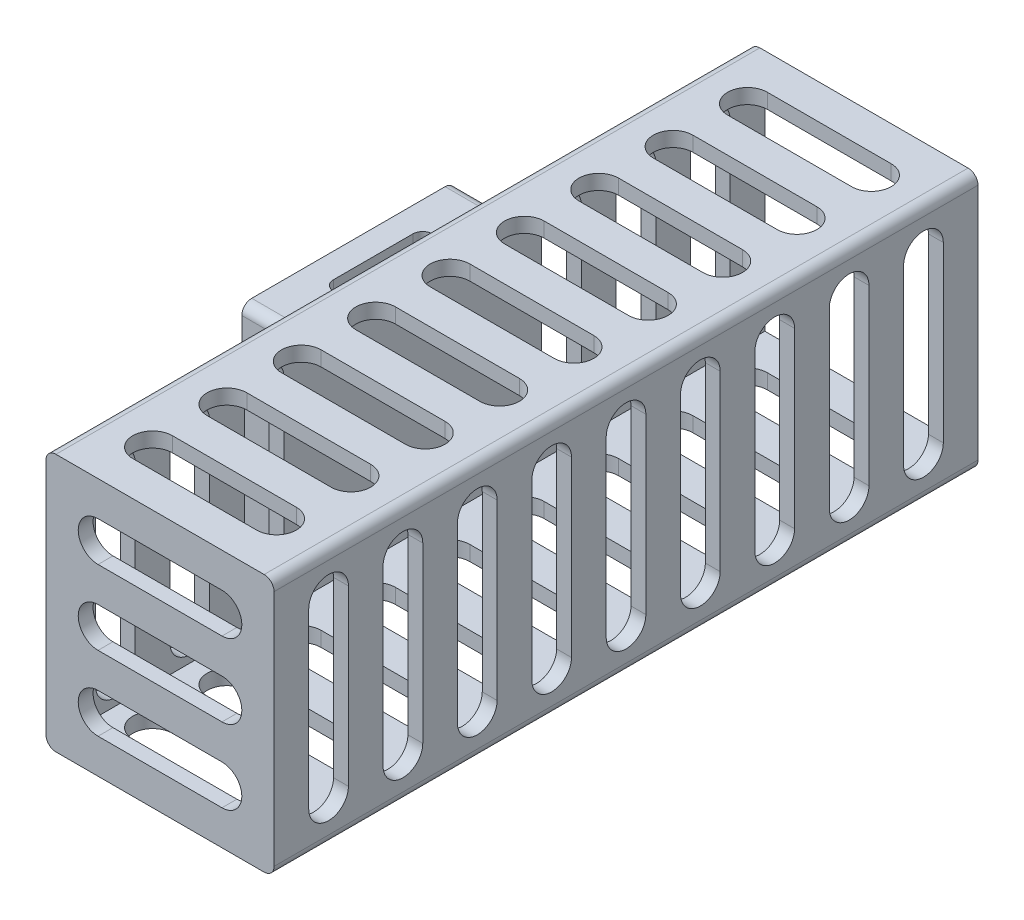
from build123d import *

# Parameters (mm, degrees)
SKETCH_1_W           = 49
SKETCH_1_H           = 43
SKETCH_1_W_2         = 45
SKETCH_1_H_2         = 39
EXTRUDE_1_DEPTH      = 140
SKETCH_3_W           = 49
SKETCH_3_H           = 43
EXTRUDE_1_2_DEPTH    = 2
SKETCH_4_W           = 43
SKETCH_4_H           = 43
EXTRUDE_2_DEPTH      = 10
SKETCH_5_W           = 39
SKETCH_5_H           = 39
CUT_EXTRUDE_1_DEPTH  = 5
SKETCH_6_W           = 5
SKETCH_6_H           = 20
CUT_EXTRUDE_2_DEPTH  = 151.463450711
SKETCH_8_W           = 20
SKETCH_8_H           = 8
EXTRUDE_4_DEPTH      = 5
SKETCH_9_W           = 29.5
SKETCH_9_H           = 15.5
CUT_EXTRUDE_3_DEPTH  = 5
SKETCH_10_R          = 1.5
CUT_EXTRUDE_4_DEPTH  = 3
CUT_EXTRUDE_START    = -3
SKETCH_11_R          = 1.5
CUT_EXTRUDE_5_DEPTH  = 3
FILLET_1_R           = 2
SKETCH_12_W          = 10.000025874
SKETCH_12_H          = 8
CUT_EXTRUDE_6_DEPTH  = 5
FILLET_2_R           = 2
FILLET_3_R           = 2
FILLET_4_R           = 2
SKETCH_14_W          = 49
SKETCH_14_H          = 43
CUT_EXTRUDE_7_DEPTH  = 148.704096084
SKETCH_15_W          = 142
SKETCH_15_H          = 52
EXTRUDE_5_DEPTH      = 46
SKETCH_16_W          = 40
SKETCH_16_H          = 46
CUT_EXTRUDE_8_DEPTH  = 139
CUT_EXTRUDE_9_DEPTH  = 154.278341588
CUT_EXTRUDE_10_DEPTH = 10
CUT_EXTRUDE_START_2  = -10
CUT_EXTRUDE_11_DEPTH = 10
FILLET_5_R           = 2
CUT_EXTRUDE_12_DEPTH = 10


with BuildPart() as part:
    # 草图1 → Extrude 1 (new body)
    with BuildSketch(Plane.XY):
        Rectangle(SKETCH_1_W, SKETCH_1_H)
        Rectangle(SKETCH_1_W_2, SKETCH_1_H_2, mode=Mode.SUBTRACT)
    extrude(amount=EXTRUDE_1_DEPTH)

    # 草图3 → Extrude 1 2 (add)
    with BuildSketch(Plane(origin=(0, 0, 0), x_dir=(-1, 0, 0), z_dir=(0, 0, -1))):
        Rectangle(SKETCH_3_W, SKETCH_3_H)
    extrude(amount=EXTRUDE_1_2_DEPTH)

    # 草图4 → 凸台-拉伸2 (add)
    with BuildSketch(Plane.ZY.offset(24.5)):
        with Locations((69, 0)):
            Rectangle(SKETCH_4_W, SKETCH_4_H)
    extrude(amount=EXTRUDE_2_DEPTH)

    # 草图5 → 切除-拉伸1 (cut)
    with BuildSketch(Plane.ZY.offset(34.5)):
        with Locations((69, 0)):
            Rectangle(SKETCH_5_W, SKETCH_5_H)
    extrude(amount=-CUT_EXTRUDE_1_DEPTH, mode=Mode.SUBTRACT)

    # 草图6 → 切除-拉伸2 (cut, through all)
    with BuildSketch(Plane(origin=(0, 21.5, 0), x_dir=(1, 0, 0), z_dir=(0, 1, 0))):
        with Locations((-27, -69)):
            Rectangle(SKETCH_6_W, SKETCH_6_H)
    extrude(amount=-CUT_EXTRUDE_2_DEPTH, mode=Mode.SUBTRACT)

    # 草图8 → 凸台-拉伸4 (add)
    with BuildSketch(Plane.ZY.offset(24.5)):
        with Locations((69, 0)):
            Rectangle(SKETCH_8_W, SKETCH_8_H)
    extrude(amount=EXTRUDE_4_DEPTH)

    # 草图9 → 切除-拉伸3 (cut)
    with BuildSketch(Plane.ZY.offset(29.5)):
        with Locations((69, 11.75)):
            Rectangle(SKETCH_9_W, SKETCH_9_H)
        with Locations((69, -11.75)):
            Rectangle(SKETCH_9_W, SKETCH_9_H)
    extrude(amount=-CUT_EXTRUDE_3_DEPTH, mode=Mode.SUBTRACT)

    # 草图10 → 切除-拉伸4 (cut)
    with BuildSketch(Plane.XZ.offset(4)):
        with Locations((-27, 78.5)):
            Circle(SKETCH_10_R)
        with Locations(Location((-27, 59.5, 0), (0, 0, 180))):
            Circle(SKETCH_10_R)
    extrude(amount=-CUT_EXTRUDE_4_DEPTH, mode=Mode.SUBTRACT)

    # 草图11 → 切除-拉伸5 (cut)
    with BuildSketch(Plane(origin=(0, 4, 0), x_dir=(1, 0, 0), z_dir=(0, 1, 0)).offset(CUT_EXTRUDE_START)):
        with Locations(Location((-27, -59.5, 0), (0, 0, 180))):
            Circle(SKETCH_11_R)
        with Locations((-27, -78.5)):
            Circle(SKETCH_11_R)
    extrude(amount=CUT_EXTRUDE_5_DEPTH, mode=Mode.SUBTRACT)

    # 圆角1
    fillet_1_edges = [part.edges().sort_by_distance(p)[0] for p in [
        (-24.5, 20.5, 79),
        (-24.5, 20.5, 59),
        (-29.5, -20.5, 79),
        (-29.5, 20.5, 79),
        (-29.5, -20.5, 59),
        (-29.5, 20.5, 59),
        (-24.5, -20.5, 59),
        (-24.5, -20.5, 79),
    ]]
    fillet(fillet_1_edges, radius=FILLET_1_R)

    # 草图12 → 切除-拉伸6 (cut)
    with BuildSketch(Plane.ZY.offset(29.5)):
        with Locations((69, 0)):
            Rectangle(SKETCH_12_W, SKETCH_12_H)
    extrude(amount=-CUT_EXTRUDE_6_DEPTH, mode=Mode.SUBTRACT)

    # 圆角2
    fillet_2_edges = [part.edges().sort_by_distance(p)[0] for p in [
        (-32, -19.5, 49.5),
        (-32, 19.5, 49.5),
        (-32, 19.5, 88.5),
        (-32, -19.5, 88.5),
    ]]
    fillet(fillet_2_edges, radius=FILLET_2_R)

    # 圆角3
    fillet_3_edges = [part.edges().sort_by_distance(p)[0] for p in [
        (-29.5, 21.5, 47.5),
        (-29.5, -21.5, 47.5),
        (-29.5, -21.5, 90.5),
        (-29.5, 21.5, 90.5),
    ]]
    fillet(fillet_3_edges, radius=FILLET_3_R)

    # 圆角4
    fillet_4_edges = [part.edges().sort_by_distance(p)[0] for p in [
        (-27, 4, 83.75),
        (-27, 19.5, 54.25),
        (-27, 4, 54.25),
        (-27, 19.5, 83.75),
        (-27, -4, 54.25),
        (-27, -19.5, 83.75),
        (-27, -19.5, 54.25),
        (-27, -4, 83.75),
    ]]
    fillet(fillet_4_edges, radius=FILLET_4_R)

    # 草图14 → 切除-拉伸7 (cut, through all)
    with BuildSketch(Plane.XY.offset(140)):
        Rectangle(SKETCH_14_W, SKETCH_14_H)
    extrude(amount=-CUT_EXTRUDE_7_DEPTH, mode=Mode.SUBTRACT)

    # 草图15 → 凸台-拉伸5 (add)
    with BuildSketch(Plane(origin=(-24.5, 0, 0), x_dir=(0, 0, -1), z_dir=(1, 0, 0))):
        with Locations((-69, 0)):
            Rectangle(SKETCH_15_W, SKETCH_15_H)
    extrude(amount=EXTRUDE_5_DEPTH)

    # 草图16 → 切除-拉伸8 (cut)
    with BuildSketch(Plane(origin=(0, 0, -2), x_dir=(-1, 0, 0), z_dir=(0, 0, -1))):
        with Locations((1.5, 0)):
            Rectangle(SKETCH_16_W, SKETCH_16_H)
    extrude(amount=-CUT_EXTRUDE_8_DEPTH, mode=Mode.SUBTRACT)

    # 草图17 → 切除-拉伸9 (cut, through all)
    with BuildSketch(Plane.XZ.offset(26)):
        with BuildLine():
            Line((-14, 73), (11, 73))
            ThreePointArc((11, 73), (15, 69), (11, 65))
            Line((11, 65), (-14, 65))
            ThreePointArc((-14, 65), (-18, 69), (-14, 73))
        make_face()
        with BuildLine():
            Line((-14, 80), (11, 80))
            ThreePointArc((11, 80), (15, 84), (11, 88))
            Line((11, 88), (-14, 88))
            ThreePointArc((-14, 88), (-18, 84), (-14, 80))
        make_face()
        with BuildLine():
            Line((-14, 95), (11, 95))
            ThreePointArc((11, 95), (15, 99), (11, 103))
            Line((11, 103), (-14, 103))
            ThreePointArc((-14, 103), (-18, 99), (-14, 95))
        make_face()
        with BuildLine():
            Line((-14, 110), (11, 110))
            ThreePointArc((11, 110), (15, 114), (11, 118))
            Line((11, 118), (-14, 118))
            ThreePointArc((-14, 118), (-18, 114), (-14, 110))
        make_face()
        with BuildLine():
            Line((-14, 125), (11, 125))
            ThreePointArc((11, 125), (15, 129), (11, 133))
            Line((11, 133), (-14, 133))
            ThreePointArc((-14, 133), (-18, 129), (-14, 125))
        make_face()
        with BuildLine():
            Line((-14, 50), (11, 50))
            ThreePointArc((11, 50), (15, 54), (11, 58))
            Line((11, 58), (-14, 58))
            ThreePointArc((-14, 58), (-18, 54), (-14, 50))
        make_face()
        with BuildLine():
            Line((-14, 35), (11, 35))
            ThreePointArc((11, 35), (15, 39), (11, 43))
            Line((11, 43), (-14, 43))
            ThreePointArc((-14, 43), (-18, 39), (-14, 35))
        make_face()
        with BuildLine():
            Line((-14, 20), (11, 20))
            ThreePointArc((11, 20), (15, 24), (11, 28))
            Line((11, 28), (-14, 28))
            ThreePointArc((-14, 28), (-18, 24), (-14, 20))
        make_face()
        with BuildLine():
            Line((-14, 5), (11, 5))
            ThreePointArc((11, 5), (15, 9), (11, 13))
            Line((11, 13), (-14, 13))
            ThreePointArc((-14, 13), (-18, 9), (-14, 5))
        make_face()
    extrude(amount=-CUT_EXTRUDE_9_DEPTH, mode=Mode.SUBTRACT)

    # 草图18 → 切除-拉伸10 (cut)
    with BuildSketch(Plane(origin=(21.5, 0, 0), x_dir=(0, 0, -1), z_dir=(1, 0, 0))):
        with BuildLine():
            Line((-65, 17.5), (-65, -17.5))
            ThreePointArc((-65, -17.5), (-69, -21.5), (-73, -17.5))
            Line((-73, -17.5), (-73, 17.5))
            ThreePointArc((-73, 17.5), (-69, 21.5), (-65, 17.5))
        make_face()
        with BuildLine():
            Line((-58, 17.5), (-58, -17.5))
            ThreePointArc((-58, -17.5), (-54, -21.5), (-50, -17.5))
            Line((-50, -17.5), (-50, 17.5))
            ThreePointArc((-50, 17.5), (-54, 21.5), (-58, 17.5))
        make_face()
        with BuildLine():
            Line((-43, 17.5), (-43, -17.5))
            ThreePointArc((-43, -17.5), (-39, -21.5), (-35, -17.5))
            Line((-35, -17.5), (-35, 17.5))
            ThreePointArc((-35, 17.5), (-39, 21.5), (-43, 17.5))
        make_face()
        with BuildLine():
            Line((-28, 17.5), (-28, -17.5))
            ThreePointArc((-28, -17.5), (-24, -21.5), (-20, -17.5))
            Line((-20, -17.5), (-20, 17.5))
            ThreePointArc((-20, 17.5), (-24, 21.5), (-28, 17.5))
        make_face()
        with BuildLine():
            Line((-13, 17.5), (-13, -17.5))
            ThreePointArc((-13, -17.5), (-9, -21.5), (-5, -17.5))
            Line((-5, -17.5), (-5, 17.5))
            ThreePointArc((-5, 17.5), (-9, 21.5), (-13, 17.5))
        make_face()
        with BuildLine():
            Line((-88, 17.5), (-88, -17.5))
            ThreePointArc((-88, -17.5), (-84, -21.5), (-80, -17.5))
            Line((-80, -17.5), (-80, 17.5))
            ThreePointArc((-80, 17.5), (-84, 21.5), (-88, 17.5))
        make_face()
        with BuildLine():
            Line((-103, 17.5), (-103, -17.5))
            ThreePointArc((-103, -17.5), (-99, -21.5), (-95, -17.5))
            Line((-95, -17.5), (-95, 17.5))
            ThreePointArc((-95, 17.5), (-99, 21.5), (-103, 17.5))
        make_face()
        with BuildLine():
            Line((-118, 17.5), (-118, -17.5))
            ThreePointArc((-118, -17.5), (-114, -21.5), (-110, -17.5))
            Line((-110, -17.5), (-110, 17.5))
            ThreePointArc((-110, 17.5), (-114, 21.5), (-118, 17.5))
        make_face()
        with BuildLine():
            Line((-133, 17.5), (-133, -17.5))
            ThreePointArc((-133, -17.5), (-129, -21.5), (-125, -17.5))
            Line((-125, -17.5), (-125, 17.5))
            ThreePointArc((-125, 17.5), (-129, 21.5), (-133, 17.5))
        make_face()
    extrude(amount=-CUT_EXTRUDE_10_DEPTH, mode=Mode.SUBTRACT)

    # 草图19 → 切除-拉伸11 (cut)
    with BuildSketch(Plane.ZY.offset(24.5).offset(CUT_EXTRUDE_START_2)):
        with BuildLine():
            Line((95, 17.5), (95, -17.5))
            ThreePointArc((95, -17.5), (99, -21.5), (103, -17.5))
            Line((103, -17.5), (103, 17.5))
            ThreePointArc((103, 17.5), (99, 21.5), (95, 17.5))
        make_face()
        with BuildLine():
            Line((110, 17.5), (110, -17.5))
            ThreePointArc((110, -17.5), (114, -21.5), (118, -17.5))
            Line((118, -17.5), (118, 17.5))
            ThreePointArc((118, 17.5), (114, 21.5), (110, 17.5))
        make_face()
        with BuildLine():
            Line((125, 17.5), (125, -17.5))
            ThreePointArc((125, -17.5), (129, -21.5), (133, -17.5))
            Line((133, -17.5), (133, 17.5))
            ThreePointArc((133, 17.5), (129, 21.5), (125, 17.5))
        make_face()
        with BuildLine():
            Line((35, 17.5), (35, -17.5))
            ThreePointArc((35, -17.5), (39, -21.5), (43, -17.5))
            Line((43, -17.5), (43, 17.5))
            ThreePointArc((43, 17.5), (39, 21.5), (35, 17.5))
        make_face()
        with BuildLine():
            Line((20, 17.5), (20, -17.5))
            ThreePointArc((20, -17.5), (24, -21.5), (28, -17.5))
            Line((28, -17.5), (28, 17.5))
            ThreePointArc((28, 17.5), (24, 21.5), (20, 17.5))
        make_face()
        with BuildLine():
            Line((5, 17.5), (5, -17.5))
            ThreePointArc((5, -17.5), (9, -21.5), (13, -17.5))
            Line((13, -17.5), (13, 17.5))
            ThreePointArc((13, 17.5), (9, 21.5), (5, 17.5))
        make_face()
    extrude(amount=CUT_EXTRUDE_11_DEPTH, mode=Mode.SUBTRACT)

    # 圆角5
    fillet_5_edges = [part.edges().sort_by_distance(p)[0] for p in [
        (-24.5, -26, 69),
        (-24.5, 26, 69),
        (21.5, -26, 69),
        (21.5, 26, 69),
    ]]
    fillet(fillet_5_edges, radius=FILLET_5_R)

    # 草图20 → 切除-拉伸12 (cut)
    with BuildSketch(Plane.XY.offset(140)):
        with BuildLine():
            Line((-14, 4), (11, 4))
            ThreePointArc((11, 4), (15, 0), (11, -4))
            Line((11, -4), (-14, -4))
            ThreePointArc((-14, -4), (-18, 0), (-14, 4))
        make_face()
        with BuildLine():
            Line((-14, 11), (11, 11))
            ThreePointArc((11, 11), (15, 15), (11, 19))
            Line((11, 19), (-14, 19))
            ThreePointArc((-14, 19), (-18, 15), (-14, 11))
        make_face()
        with BuildLine():
            Line((-14, -19), (11, -19))
            ThreePointArc((11, -19), (15, -15), (11, -11))
            Line((11, -11), (-14, -11))
            ThreePointArc((-14, -11), (-18, -15), (-14, -19))
        make_face()
    extrude(amount=-CUT_EXTRUDE_12_DEPTH, mode=Mode.SUBTRACT)


solid = part.part
